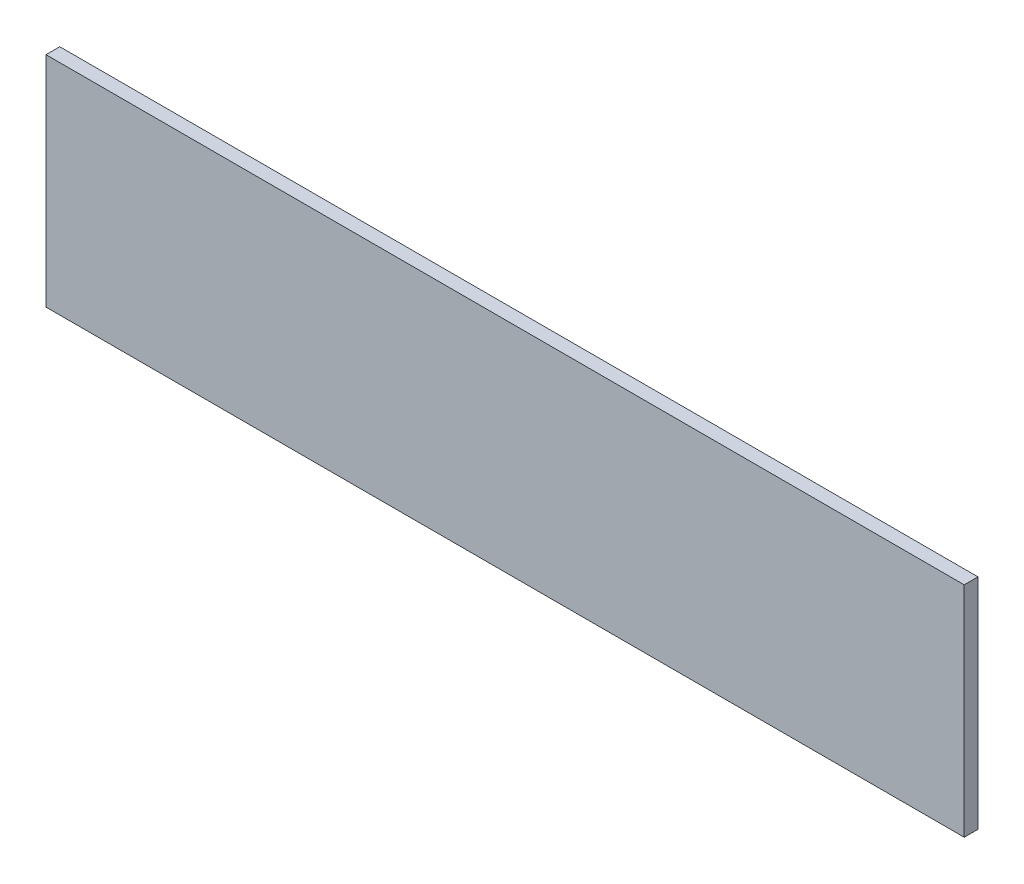
from build123d import *

# Parameters (mm, degrees)
SKETCH1_W           = 106.68
SKETCH1_H           = 25.4
BOSS_EXTRUDE1_DEPTH = 1.6


with BuildPart() as part:
    # Sketch1 → Boss-Extrude1 (new body)
    with BuildSketch(Plane.XY):
        Rectangle(SKETCH1_W, SKETCH1_H)
    extrude(amount=BOSS_EXTRUDE1_DEPTH)


solid = part.part
